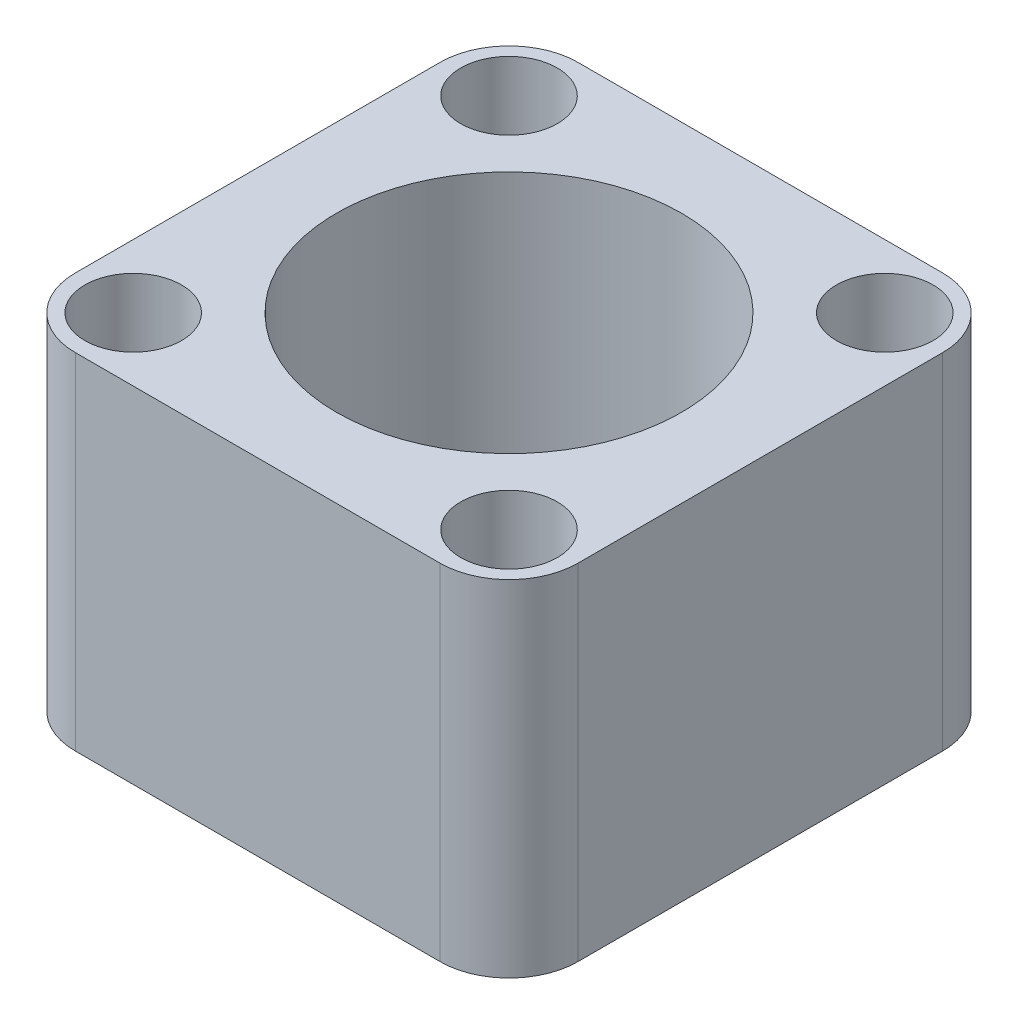
from build123d import *

# Parameters (mm, degrees)
SKETCH3_W           = 18.499327609
SKETCH3_H           = 18.499327609
BOSS_EXTRUDE2_DEPTH = 12.7
FILLET2_R           = 2.54
SKETCH4_R           = 6.35
SKETCH4_R_2         = 1.778
CUT_EXTRUDE1_DEPTH  = 12.7


with BuildPart() as part:
    # Sketch3 → Boss-Extrude2 (new body)
    with BuildSketch(Plane(origin=(0, 0, 0), x_dir=(1, 0, 0), z_dir=(0, 1, 0))):
        with Locations((-9.249663805, 9.249663805)):
            Rectangle(SKETCH3_W, SKETCH3_H)
    extrude(amount=BOSS_EXTRUDE2_DEPTH)

    # Fillet2
    fillet2_edges = [part.edges().sort_by_distance(p)[0] for p in [
        (0, 6.35, 0),
        (-18.499327609, 6.35, 0),
        (-18.499327609, 6.35, -18.499327609),
        (0, 6.35, -18.499327609),
    ]]
    fillet(fillet2_edges, radius=FILLET2_R)

    # Sketch4 → Cut-Extrude1 (cut)
    with BuildSketch(Plane(origin=(0, 12.7, 0), x_dir=(1, 0, 0), z_dir=(0, 1, 0))):
        with Locations(Location((-9.249663805, 9.249663805, 0), (0, 0, 270))):
            Circle(SKETCH4_R)
        with Locations(Location((-2.334866591, 2.334866591, 0), (0, 0, 270))):
            Circle(SKETCH4_R_2)
        with Locations(Location((-16.164461018, 2.334866591, 0), (0, 0, 270))):
            Circle(SKETCH4_R_2)
        with Locations(Location((-16.164461018, 16.164461018, 0), (0, 0, 270))):
            Circle(SKETCH4_R_2)
        with Locations(Location((-2.334866591, 16.164461018, 0), (0, 0, 270))):
            Circle(SKETCH4_R_2)
    extrude(amount=-CUT_EXTRUDE1_DEPTH, mode=Mode.SUBTRACT)


solid = part.part
